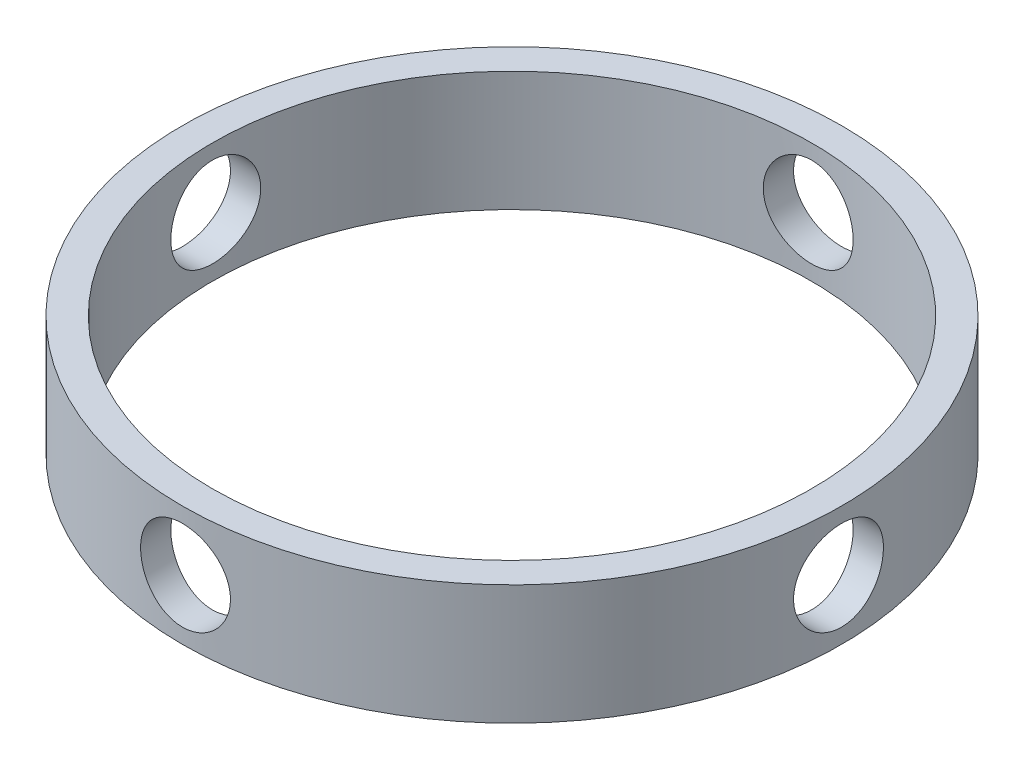
from build123d import *

# Parameters (mm, degrees)
SKETCH1_R               = 55
SKETCH1_R_2             = 50
BOSS_EXTRUDE1_DEPTH     = 20
CUT_EXTRUDE1_DEPTH      = 81.311892021
CUT_EXTRUDE1_DEPTH_BACK = 81.311892021
SKETCH2_R               = 7.5
CUT_EXTRUDE2_DEPTH      = 81.311892183
CUT_EXTRUDE2_DEPTH_BACK = 81.311892183
SKETCH3_R               = 7.5


with BuildPart() as part:
    # Sketch1 → Boss-Extrude1 (new body)
    with BuildSketch(Plane(origin=(0, 0, 0), x_dir=(1, 0, 0), z_dir=(0, 1, 0))):
        with Locations(Location((0, 0, 0), (0, 0, 270))):
            Circle(SKETCH1_R)
        with Locations(Location((0, 0, 0), (0, 0, 270))):
            Circle(SKETCH1_R_2, mode=Mode.SUBTRACT)
    extrude(amount=BOSS_EXTRUDE1_DEPTH)

    # Sketch2 → Cut-Extrude1 (cut, two sides: drawn at the far end of the back side and taken through both)
    with BuildSketch(Plane.XY.offset(-CUT_EXTRUDE1_DEPTH_BACK)):
        with Locations((0, 10)):
            Circle(SKETCH2_R)
    extrude(amount=CUT_EXTRUDE1_DEPTH + CUT_EXTRUDE1_DEPTH_BACK, mode=Mode.SUBTRACT)

    # Sketch3 → Cut-Extrude2 (cut, two sides: drawn at the far end of the back side and taken through both)
    with BuildSketch(Plane(origin=(0, 0, 0), x_dir=(0, 0, -1), z_dir=(1, 0, 0)).offset(-CUT_EXTRUDE2_DEPTH_BACK)):
        with Locations((0, 10)):
            Circle(SKETCH3_R)
    extrude(amount=CUT_EXTRUDE2_DEPTH + CUT_EXTRUDE2_DEPTH_BACK, mode=Mode.SUBTRACT)


solid = part.part
